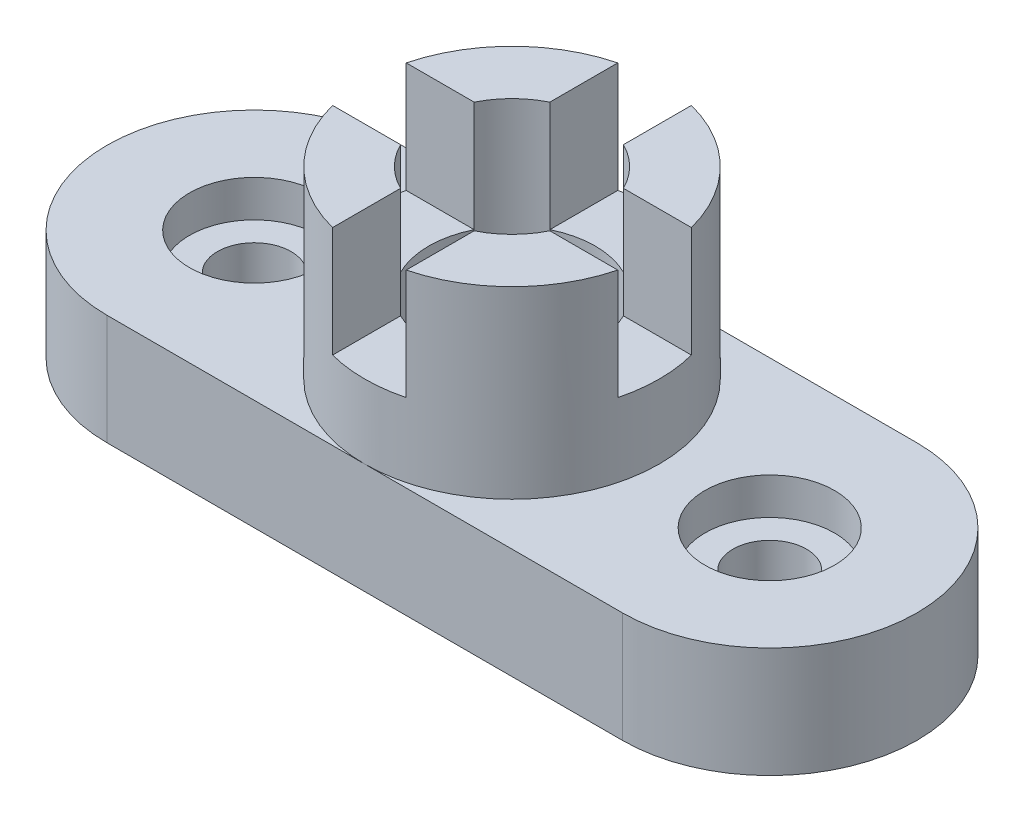
from build123d import *

# Parameters (mm, degrees)
SKETCH1_R             = 11.176
BOSS_EXTRUDE1_DEPTH   = 19.05
BOSS_EXTRUDE1_2_DEPTH = 19.05
BOSS_EXTRUDE2_DEPTH   = 50.8
BOSS_EXTRUDE3_DEPTH   = 31.75
SKETCH1_5_R           = 11.176
SKETCH1_5_R_2         = 6.35
BOSS_EXTRUDE4_DEPTH   = 12.7


with BuildPart() as part:
    # Sketch1 → Boss-Extrude1 (new body)
    with BuildSketch(Plane(origin=(0, 0, 0), x_dir=(1, 0, 0), z_dir=(0, 1, 0))):
        with BuildLine():
            ThreePointArc((-63.02104825, 25.4), (-88.42104825, 0), (-63.02104825, -25.4))
            Line((-63.02104825, -25.4), (-18.57104825, -25.4))
            ThreePointArc((-18.57104825, -25.4), (-43.97104825, -1.3e-08), (-18.571048276, 25.4))
            Line((-18.571048276, 25.4), (-63.02104825, 25.4))
        make_face()
        with Locations(Location((-63.02104825, 0, 0), (0, 0, 90))):
            Circle(SKETCH1_R, mode=Mode.SUBTRACT)
    extrude(amount=BOSS_EXTRUDE1_DEPTH)



with BuildPart() as body_2:
    # Sketch1 → Boss-Extrude1 2 (new body)
    with BuildSketch(Plane(origin=(0, 0, 0), x_dir=(1, 0, 0), z_dir=(0, 1, 0))):
        with BuildLine():
            ThreePointArc((-18.571048276, 25.4), (6.82895175, 1.3e-08), (-18.57104825, -25.4))
            Line((-18.57104825, -25.4), (25.87895175, -25.4))
            ThreePointArc((25.87895175, -25.4), (51.27895175, 0), (25.87895175, 25.4))
            Line((25.87895175, 25.4), (-18.571048276, 25.4))
        make_face()
        with Locations(Location((25.87895175, 0, 0), (0, 0, 90))):
            Circle(SKETCH1_R, mode=Mode.SUBTRACT)
    extrude(amount=BOSS_EXTRUDE1_2_DEPTH)


with BuildPart() as part_1:
    add(part.part)

    add(body_2.part)  # Boss-Extrude2 merges body 2
    # Sketch1<3> → Boss-Extrude2 (add)
    with BuildSketch(Plane(origin=(0, 0, 0), x_dir=(1, 0, 0), z_dir=(0, 1, 0))):
        with BuildLine():
            Line((-24.92104825, 12.869681465), (-24.92104825, 24.593444248))
            ThreePointArc((-24.92104825, 24.593444248), (-36.531560492, 17.960512242), (-43.164492498, 6.35))
            Line((-43.164492498, 6.35), (-31.440729714, 6.35))
            ThreePointArc((-31.440729714, 6.35), (-28.718737667, 10.147689417), (-24.92104825, 12.869681465))
        make_face()
        with BuildLine():
            ThreePointArc((6.022395999, 6.35), (-0.610536008, 17.960512242), (-12.22104825, 24.593444248))
            Line((-12.22104825, 24.593444248), (-12.22104825, 12.869681465))
            ThreePointArc((-12.22104825, 12.869681465), (-8.423358833, 10.147689417), (-5.701366785, 6.35))
            Line((-5.701366785, 6.35), (6.022395999, 6.35))
        make_face()
        with BuildLine():
            ThreePointArc((-43.164492498, -6.35), (-36.531560492, -17.960512242), (-24.92104825, -24.593444248))
            Line((-24.92104825, -24.593444248), (-24.92104825, -12.869681465))
            ThreePointArc((-24.92104825, -12.869681465), (-28.718737667, -10.147689417), (-31.440729714, -6.35))
            Line((-31.440729714, -6.35), (-43.164492498, -6.35))
        make_face()
        with BuildLine():
            Line((-12.22104825, -12.869681465), (-12.22104825, -24.593444248))
            ThreePointArc((-12.22104825, -24.593444248), (-0.610536008, -17.960512242), (6.022395999, -6.35))
            Line((6.022395999, -6.35), (-5.701366785, -6.35))
            ThreePointArc((-5.701366785, -6.35), (-8.423358833, -10.147689417), (-12.22104825, -12.869681465))
        make_face()
    extrude(amount=BOSS_EXTRUDE2_DEPTH)

    # Sketch1<4> → Boss-Extrude3 (add)
    with BuildSketch(Plane(origin=(0, 0, 0), x_dir=(1, 0, 0), z_dir=(0, 1, 0))):
        with BuildLine():
            ThreePointArc((-18.571048276, 25.4), (-21.771557292, 25.197554284), (-24.92104825, 24.593444248))
            Line((-24.92104825, 24.593444248), (-24.92104825, 12.869681465))
            ThreePointArc((-24.92104825, 12.869681465), (-18.57104825, 14.351), (-12.22104825, 12.869681465))
            Line((-12.22104825, 12.869681465), (-12.22104825, 24.593444248))
            ThreePointArc((-12.22104825, 24.593444248), (-15.370539234, 25.197554287), (-18.571048276, 25.4))
        make_face()
        with BuildLine():
            Line((-24.92104825, -12.869681465), (-24.92104825, -24.593444248))
            ThreePointArc((-24.92104825, -24.593444248), (-21.771557279, -25.197554285), (-18.57104825, -25.4))
            ThreePointArc((-18.57104825, -25.4), (-15.370539221, -25.197554285), (-12.22104825, -24.593444248))
            Line((-12.22104825, -24.593444248), (-12.22104825, -12.869681465))
            ThreePointArc((-12.22104825, -12.869681465), (-18.57104825, -14.351), (-24.92104825, -12.869681465))
        make_face()
        with BuildLine():
            ThreePointArc((-43.164492498, 6.35), (-43.768602535, 3.200509029), (-43.97104825, 0))
            Line((-43.97104825, 0), (-32.92204825, 0))
            ThreePointArc((-32.92204825, 0), (-32.546812982, 3.260245566), (-31.440729714, 6.35))
            Line((-31.440729714, 6.35), (-43.164492498, 6.35))
        make_face()
        with BuildLine():
            ThreePointArc((-5.701366785, 6.35), (-4.595283518, 3.260245566), (-4.22004825, 0))
            Line((-4.22004825, 0), (6.82895175, 0))
            ThreePointArc((6.82895175, 0), (6.626506035, 3.200509029), (6.022395999, 6.35))
            Line((6.022395999, 6.35), (-5.701366785, 6.35))
        make_face()
        with BuildLine():
            Line((-32.92204825, 0), (-43.97104825, 0))
            ThreePointArc((-43.97104825, 0), (-43.768602535, -3.200509029), (-43.164492498, -6.35))
            Line((-43.164492498, -6.35), (-31.440729714, -6.35))
            ThreePointArc((-31.440729714, -6.35), (-32.546812982, -3.260245566), (-32.92204825, 0))
        make_face()
        with BuildLine():
            Line((6.82895175, 0), (-4.22004825, 0))
            ThreePointArc((-4.22004825, 0), (-4.595283518, -3.260245566), (-5.701366785, -6.35))
            Line((-5.701366785, -6.35), (6.022395999, -6.35))
            ThreePointArc((6.022395999, -6.35), (6.626506035, -3.200509029), (6.82895175, 0))
        make_face()
    extrude(amount=BOSS_EXTRUDE3_DEPTH)

    # Sketch1<5> → Boss-Extrude4 (add)
    # profile 1 of 2: a face of its own
    with BuildSketch(Plane(origin=(0, 0, 0), x_dir=(1, 0, 0), z_dir=(0, 1, 0))):
        with Locations(Location((-63.02104825, 0, 0), (0, 0, 90))):
            Circle(SKETCH1_5_R)
        with Locations(Location((-63.02104825, 0, 0), (0, 0, 270))):
            Circle(SKETCH1_5_R_2, mode=Mode.SUBTRACT)
    # profile 2 of 2: a face of its own
    with BuildSketch(Plane(origin=(0, 0, 0), x_dir=(1, 0, 0), z_dir=(0, 1, 0))):
        with Locations(Location((25.87895175, 0, 0), (0, 0, 90))):
            Circle(SKETCH1_5_R)
        with Locations(Location((25.87895175, 0, 0), (0, 0, 270))):
            Circle(SKETCH1_5_R_2, mode=Mode.SUBTRACT)
    extrude(amount=BOSS_EXTRUDE4_DEPTH)


solid = part_1.part
